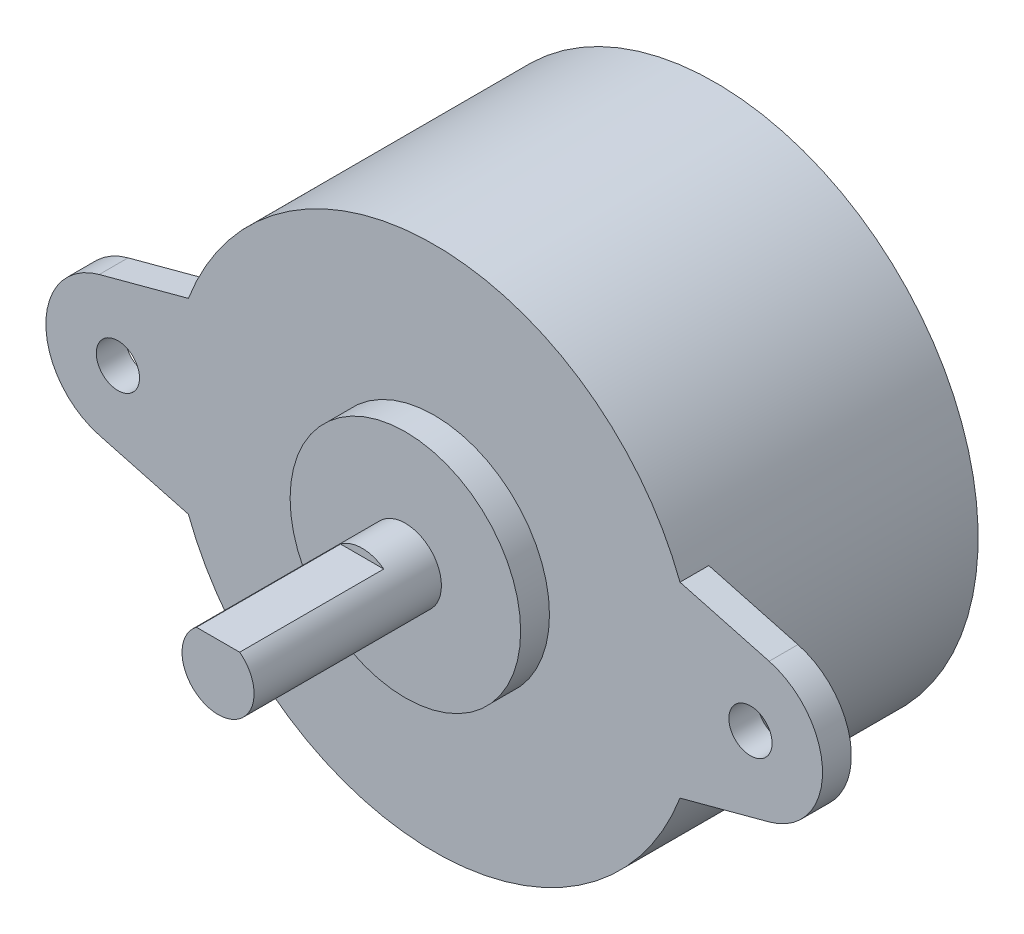
from build123d import *

# Parameters (mm, degrees)
SKETCH1_R           = 1.5
BOSS_EXTRUDE1_DEPTH = 2
SKETCH2_R           = 18.25
BOSS_EXTRUDE2_DEPTH = 17.5
SKETCH3_R           = 8
BOSS_EXTRUDE3_DEPTH = 2
SKETCH4_R           = 2.5
BOSS_EXTRUDE4_DEPTH = 13
CUT_EXTRUDE1_START  = -10
CUT_EXTRUDE1_DEPTH  = 10


with BuildPart() as part:
    # Sketch1 → Boss-Extrude1 (new body)
    with BuildSketch(Plane.XY):
        with BuildLine():
            Line((-23.244095226, 4.829629131), (-17.058114991, 6.48715754))
            ThreePointArc((-17.058114991, 6.48715754), (0, 18.25), (17.058114991, 6.48715754))
            Line((17.058114991, 6.48715754), (23.244095226, 4.829629131))
            ThreePointArc((23.244095226, 4.829629131), (26.95, 0), (23.244095226, -4.829629131))
            Line((23.244095226, -4.829629131), (17.058114991, -6.48715754))
            ThreePointArc((17.058114991, -6.48715754), (0, -18.25), (-17.058114991, -6.48715754))
            Line((-17.058114991, -6.48715754), (-23.244095226, -4.829629131))
            ThreePointArc((-23.244095226, -4.829629131), (-26.95, 0), (-23.244095226, 4.829629131))
        make_face()
        with Locations((-21.95, 0)):
            Circle(SKETCH1_R, mode=Mode.SUBTRACT)
        with Locations((21.95, 0)):
            Circle(SKETCH1_R, mode=Mode.SUBTRACT)
    extrude(amount=-BOSS_EXTRUDE1_DEPTH)

    # Sketch2 → Boss-Extrude2 (add)
    with BuildSketch(Plane(origin=(0, 0, -2), x_dir=(-1, 0, 0), z_dir=(0, 0, -1))):
        with Locations(Location((0, 0, 0), (0, 0, 200.821681464))):
            Circle(SKETCH2_R)
    extrude(amount=BOSS_EXTRUDE2_DEPTH)

    # Sketch3 → Boss-Extrude3 (add)
    with BuildSketch(Plane.XY):
        Circle(SKETCH3_R)
    extrude(amount=BOSS_EXTRUDE3_DEPTH)

    # Sketch4 → Boss-Extrude4 (add)
    with BuildSketch(Plane.XY.offset(2)):
        with Locations(Location((0, 0, 0), (0, 0, 180))):
            Circle(SKETCH4_R)
    extrude(amount=BOSS_EXTRUDE4_DEPTH)

    # Sketch5 → Cut-Extrude1 (cut)
    with BuildSketch(Plane.XY.offset(15).offset(CUT_EXTRUDE1_START)):
        with BuildLine():
            Line((1.5, 2), (-1.5, 2))
            ThreePointArc((-1.5, 2), (0, 2.5), (1.5, 2))
        make_face()
    extrude(amount=CUT_EXTRUDE1_DEPTH, mode=Mode.SUBTRACT)


solid = part.part
